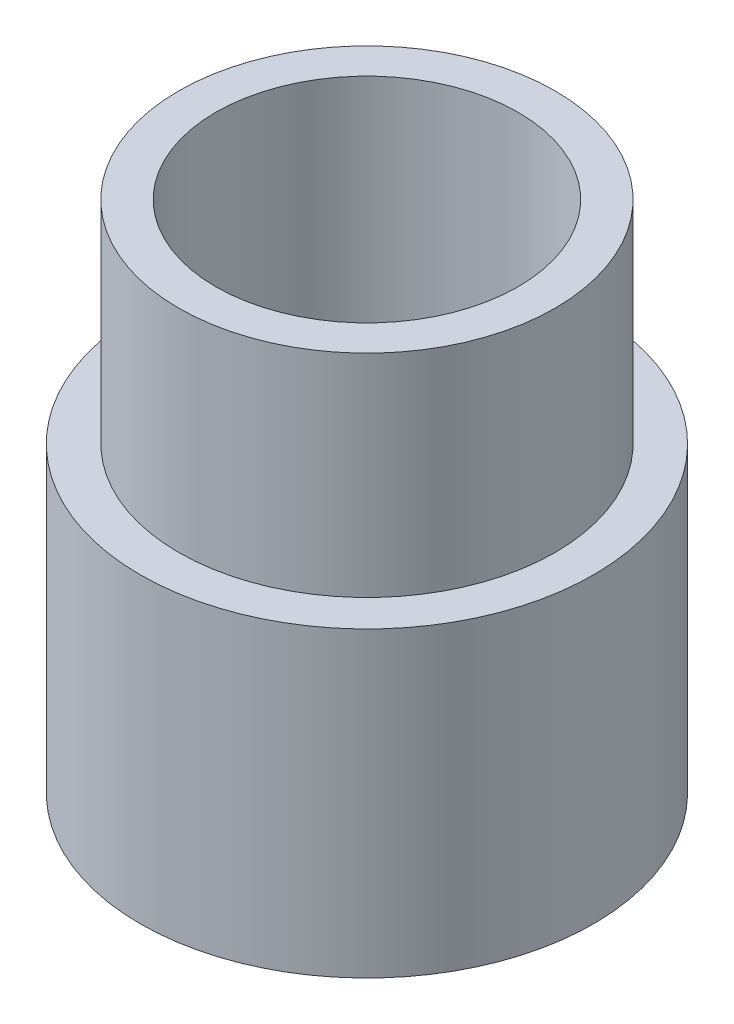
from build123d import *

# Parameters (mm, degrees)
SKETCH1_R           = 7.5
BOSS_EXTRUDE1_DEPTH = 10
SKETCH2_R           = 6.25
CUT_EXTRUDE1_DEPTH  = 7.5
SKETCH3_R           = 6.225
BOSS_EXTRUDE2_DEPTH = 7
SKETCH4_R           = 5
CUT_EXTRUDE3_DEPTH  = 10.5


with BuildPart() as part:
    # Sketch1 → Boss-Extrude1 (new body)
    with BuildSketch(Plane(origin=(0, 0, 0), x_dir=(1, 0, 0), z_dir=(0, 1, 0))):
        with Locations(Location((0, 0, 0), (0, 0, 270))):
            Circle(SKETCH1_R)
    extrude(amount=BOSS_EXTRUDE1_DEPTH)

    # Sketch2 → Cut-Extrude1 (cut)
    with BuildSketch(Plane.XZ):
        with Locations(Location((0, 0, 0), (0, 0, 270))):
            Circle(SKETCH2_R)
    extrude(amount=-CUT_EXTRUDE1_DEPTH, mode=Mode.SUBTRACT)

    # Sketch3 → Boss-Extrude2 (add)
    with BuildSketch(Plane(origin=(0, 10, 0), x_dir=(1, 0, 0), z_dir=(0, 1, 0))):
        with Locations(Location((0, 0, 0), (0, 0, 270))):
            Circle(SKETCH3_R)
    extrude(amount=BOSS_EXTRUDE2_DEPTH)

    # Sketch4 → Cut-Extrude3 (cut)
    with BuildSketch(Plane(origin=(0, 17, 0), x_dir=(1, 0, 0), z_dir=(0, 1, 0))):
        with Locations(Location((0, 0, 0), (0, 0, 270))):
            Circle(SKETCH4_R)
    extrude(amount=-CUT_EXTRUDE3_DEPTH, mode=Mode.SUBTRACT)


solid = part.part
